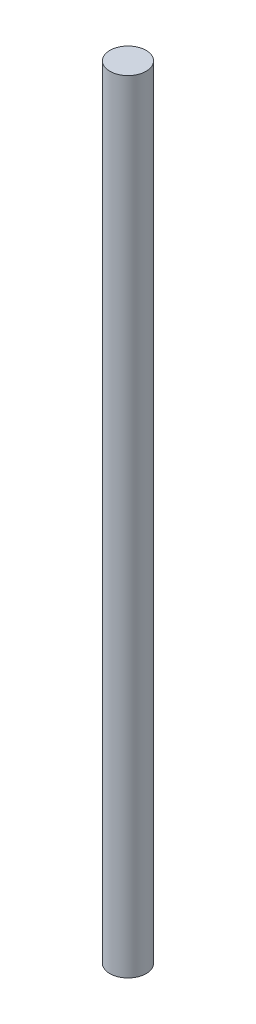
from build123d import *

# Parameters (mm, degrees)
CROQUIS1_R              = 1.925
SALIENTE_EXTRUIR1_DEPTH = 83


with BuildPart() as part:
    # Croquis1 → Saliente-Extruir1 (new body)
    with BuildSketch(Plane(origin=(0, 0, 0), x_dir=(1, 0, 0), z_dir=(0, 1, 0))):
        with Locations(Location((0, 0, 0), (0, 0, 270))):
            Circle(CROQUIS1_R)
    extrude(amount=SALIENTE_EXTRUIR1_DEPTH)


solid = part.part
